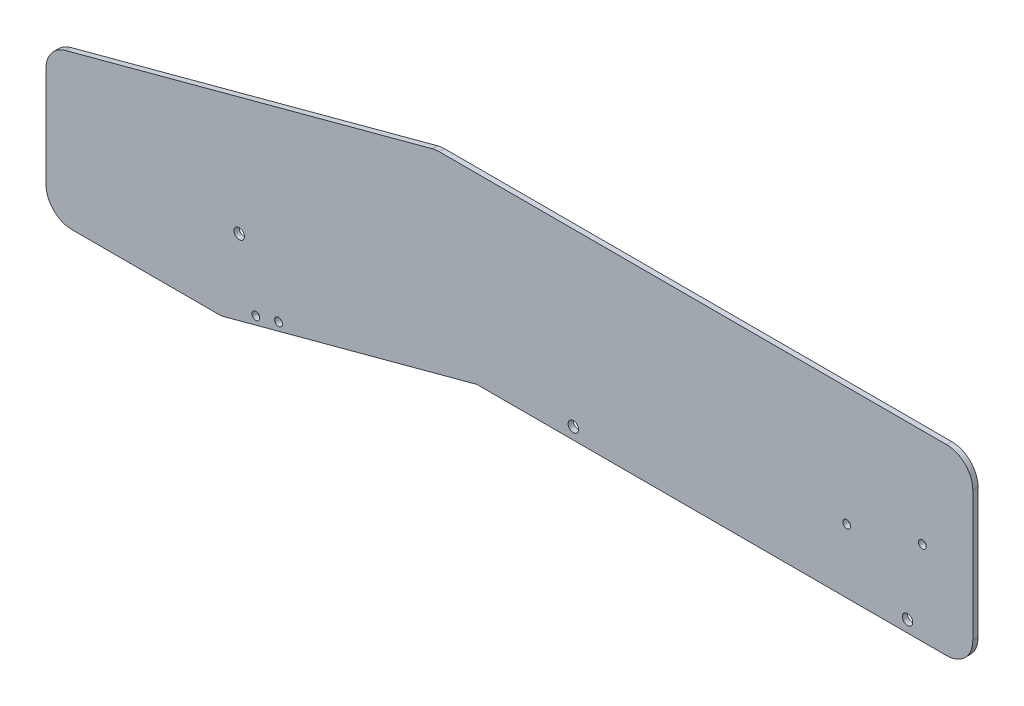
from build123d import *

# Parameters (mm, degrees)
SKETCH_1_W          = 355
SKETCH_1_H          = 70
EXTRUDE_1_DEPTH     = 2
EXTRUDE_2_DEPTH     = 2
SKETCH_3_R          = 2
CUT_EXTRUDE_1_DEPTH = 195.38294737
SKETCH_4_R          = 1.5
CUT_EXTRUDE_2_DEPTH = 195.38294737
CUT_EXTRUDE_3_DEPTH = 2
CUT_EXTRUDE_4_DEPTH = 2
FILLET_1_R          = 10


with BuildPart() as part:
    # 草图1 → 凸台-拉伸1 (new body)
    with BuildSketch(Plane.XY):
        Rectangle(SKETCH_1_W, SKETCH_1_H)
    extrude(amount=EXTRUDE_1_DEPTH)

    # 草图2 → 凸台-拉伸2 (add)
    with BuildSketch(Plane.XY.offset(2)):
        Polygon((-12.5, -35), (-177.5, -79.211616751), (-177.5, -35), align=None)
    extrude(amount=-EXTRUDE_2_DEPTH)

    # 草图3 → 切除-拉伸1 (cut, through all)
    with BuildSketch(Plane.XY.offset(2)):
        with Locations((152.5, -30.5)):
            Circle(SKETCH_3_R)
        with Locations((24.5, -30.5)):
            Circle(SKETCH_3_R)
        with Locations((-103.5, -30.5)):
            Circle(SKETCH_3_R)
    extrude(amount=-CUT_EXTRUDE_1_DEPTH, mode=Mode.SUBTRACT)

    # 草图4 → 切除-拉伸2 (cut, through all)
    with BuildSketch(Plane.XY.offset(2)):
        with Locations((-97.127512474, -54.570045084)):
            Circle(SKETCH_4_R)
        with Locations((-88.434180038, -52.240673678)):
            Circle(SKETCH_4_R)
        with Locations((129.203708686, -10.489196039)):
            Circle(SKETCH_4_R)
        with Locations((158.181483474, -2.724624685)):
            Circle(SKETCH_4_R)
    extrude(amount=-CUT_EXTRUDE_2_DEPTH, mode=Mode.SUBTRACT)

    # 草图5 → 切除-拉伸3 (cut)
    with BuildSketch(Plane.XY.offset(2)):
        Polygon((-177.5, -5), (-28.217967697, 35), (-177.5, 35), align=None)
    extrude(amount=-CUT_EXTRUDE_3_DEPTH, mode=Mode.SUBTRACT)

    # 草图6 → 切除-拉伸4 (cut)
    with BuildSketch(Plane.XY.offset(2)):
        Polygon((-110.323085464, -61.211616751), (-177.5, -61.211616751), (-177.5, -79.211616751), align=None)
    extrude(amount=-CUT_EXTRUDE_4_DEPTH, mode=Mode.SUBTRACT)

    # 圆角1
    fillet_1_edges = [part.edges().sort_by_distance(p)[0] for p in [
        (-177.5, -5, 1),
        (-28.217967697, 35, 1),
        (-177.5, -61.211616751, 1),
        (177.5, -35, 1),
        (177.5, 35, 1),
    ]]
    fillet(fillet_1_edges, radius=FILLET_1_R)


solid = part.part
